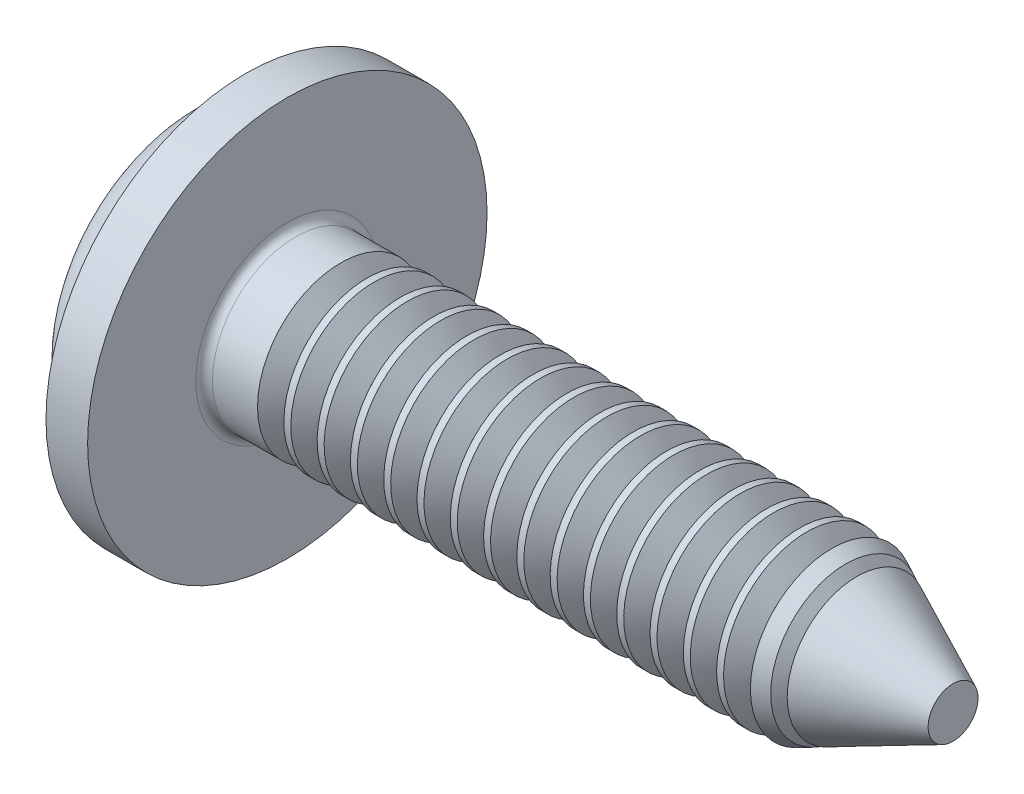
from build123d import *

# Parameters (mm, degrees)
FILLET1_R                = 0.1
RECPAT_COUNT             = 2
RECPAT_ANGLE             = 90
THDSCHPAT_COUNT          = 19
THDSCHPAT_PITCH          = 0.4
ESBO_O1_R                = 2.4
RESSALTO_EXTRUS_O1_DEPTH = 0.5
ECHELLE2_SCALE           = 2
ECHELLE3_SCALE           = 0.5
ECHELLE4_SCALE           = 0.5


with BuildPart() as part:
    # BodySke → Base-Revolve (revolve)
    with BuildSketch(Plane.XY, mode=Mode.PRIVATE) as base_revolve_sk:
        with BuildLine():
            Line((1.6, 1), (1.6, 2))
            Line((1.6, 2), (1.1, 2))
            ThreePointArc((1.1, 2), (0.688403396, 1.885994341), (0.394117647, 1.576470588))
            ThreePointArc((0.394117647, 1.576470588), (0.100022625, 0.812494344), (0, 0))
            Line((0, 0), (9.6, 0))
            Line((9.6, 0), (9.6, 1))
            Line((9.6, 1), (1.6, 1))
        make_face()
    revolve(base_revolve_sk.sketch.rotate(Axis((1.1, 0, 0), (1, 0, 0)), 90), axis=Axis((1.1, 0, 0), (1, 0, 0)))

    # Fillet1
    fillet1_edges = [part.edges().sort_by_distance(p)[0] for p in [
        (1.6, 0, -1),
    ]]
    fillet(fillet1_edges, radius=FILLET1_R)

    # Sketch3 → Recess section 0
    with BuildSketch(Plane(origin=(0, 0, 0), x_dir=(0, 0, -1), z_dir=(1, 0, 0))):
        with BuildLine():
            Line((0.24, -1.05), (-0.24, -1.05))
            Line((-0.24, -1.05), (-0.24, 1.05))
            Line((-0.24, 1.05), (0.24, 1.05))
            Line((0.24, 1.05), (0.24, -1.05))
        make_face()
    # Sketch4 → Recess section 1
    with BuildSketch(Plane(origin=(1.42, 0, 0), x_dir=(0, 0, -1), z_dir=(1, 0, 0))):
        with BuildLine():
            Line((0.24, -0.342014235), (-0.24, -0.342014235))
            Line((-0.24, -0.342014235), (-0.24, 0.342014235))
            Line((-0.24, 0.342014235), (0.24, 0.342014235))
            Line((0.24, 0.342014235), (0.24, -0.342014235))
        make_face()
    recess = loft(mode=Mode.SUBTRACT)

    # RecPat: Recess ×2 about axis
    recpat_axis = Axis((0, 0, 0), (1, 0, 0))
    for i in range(1, RECPAT_COUNT):
        add(recess.rotate(recpat_axis, i * RECPAT_ANGLE / (RECPAT_COUNT - 1)), mode=Mode.SUBTRACT)

    # RecCorSke → RecessCore (revolve, cut)
    with BuildSketch(Plane.XY, mode=Mode.PRIVATE) as recesscore_sk:
        Polygon((0, 0), (0, 0.454796073), (1.42, 0.3555), (1.535508952, 0), align=None)
    revolve(recesscore_sk.sketch.rotate(Axis((-3.175, 0, 0), (1, 0, 0)), 13.849905977), axis=Axis((-3.175, 0, 0), (1, 0, 0)), mode=Mode.SUBTRACT)

    # ThdSchSke → ThreadSchematic (revolve, cut)
    with BuildSketch(Plane.XY, mode=Mode.PRIVATE) as threadschematic_sk:
        Polygon((2.4, -0.774), (2.241753096, -1), (2.241753096, -1.25), (2.558246904, -1.25), (2.558246904, -1), align=None)
    threadschematic = revolve(threadschematic_sk.sketch.rotate(Axis((-3.175, 0, 0), (1, 0, 0)), 270), axis=Axis((-3.175, 0, 0), (1, 0, 0)), mode=Mode.SUBTRACT)

    # ThdSchPat: ThreadSchematic ×19
    with Locations(*[(i * THDSCHPAT_PITCH, 0, 0) for i in range(1, THDSCHPAT_COUNT)]):
        add(threadschematic, mode=Mode.SUBTRACT)

    # Esboço1 → Ressalto-extrusão1 (add)
    with BuildSketch(Plane(origin=(1.6, 0, 0), x_dir=(0, 0, -1), z_dir=(1, 0, 0))):
        Circle(ESBO_O1_R)
    extrude(amount=-RESSALTO_EXTRUS_O1_DEPTH)

    # Esboço2 → Corte-Revolução1 (revolve, cut)
    with BuildSketch(Plane(origin=(0, 0, 0), x_dir=(1, 0, 0), z_dir=(0, 1, 0)), mode=Mode.PRIVATE) as corte_revolu_o1_sk:
        Polygon((9.6, 0.3), (8.1, 1), (9.6, 1), align=None)
    revolve(corte_revolu_o1_sk.sketch.rotate(Axis((0, 0, 0), (1, 0, 0)), 270), axis=Axis((0, 0, 0), (1, 0, 0)), mode=Mode.SUBTRACT)


with BuildPart() as part_1:
    # Echelle2: scaled about (0, 0, 0)
    add(part.part.scale(ECHELLE2_SCALE))


with BuildPart() as part_2:
    # Echelle3: scaled about (0, 0, 0)
    add(part_1.part.scale(ECHELLE3_SCALE))


with BuildPart() as part_3:
    # Echelle4: scaled about (0, 0, 0)
    add(part_2.part.scale(ECHELLE4_SCALE))


solid = part_3.part
